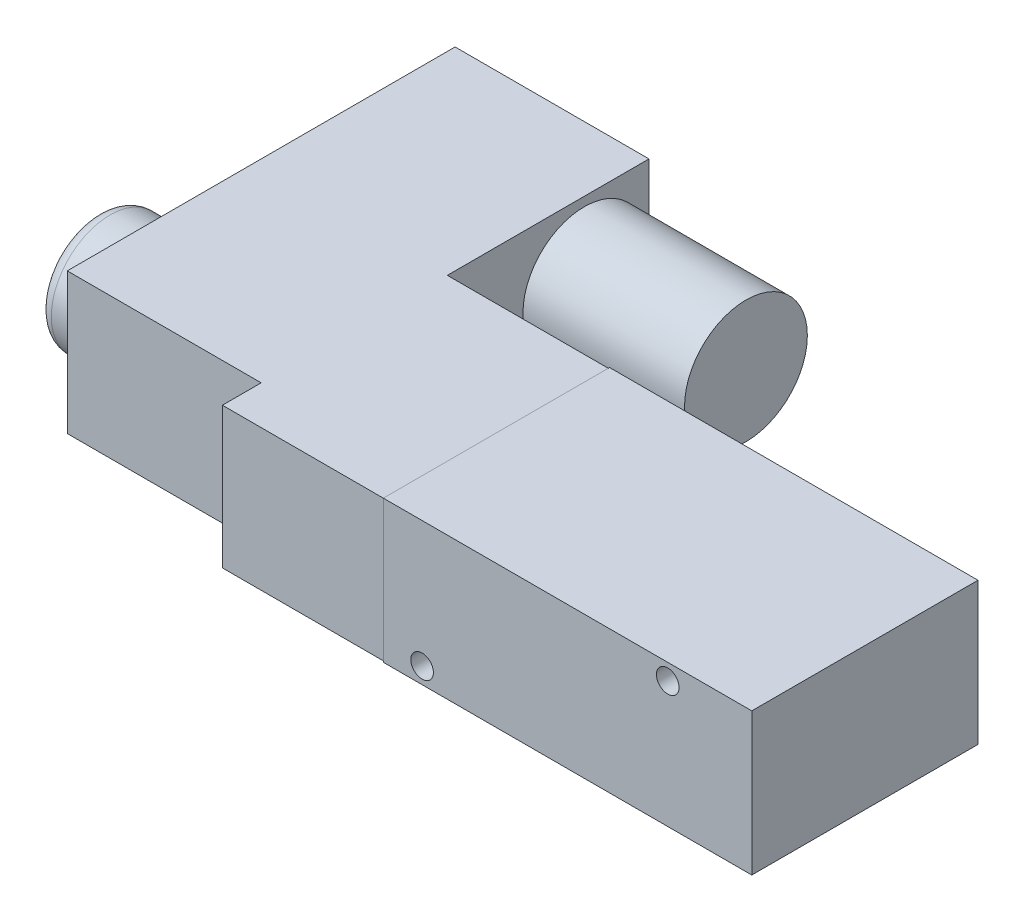
from build123d import *

# Parameters (mm, degrees)
SKETCH_1_W                 = 50
SKETCH_1_H                 = 22
EXTRUDE_1_DEPTH            = 35
SKETCH_2_R                 = 1.27968475
SKETCH_2_R_2               = 1.164740644
CUT_EXTRUDE_1_DEPTH        = 10
HOLE_WIZARD_1_2_13_1_D     = 10.71626
HOLE_WIZARD_1_2_13_1_DEPTH = 31.26
HOLE_WIZARD_1_2_13_1_TIP   = 3.219489309
CUT_EXTRUDE_2_REACH        = 46.396
SKETCH_5_R                 = 1.75
SKETCH_6_W                 = 35
SKETCH_6_H                 = 22
EXTRUDE_3_DEPTH            = 7
SKETCH_7_W                 = 34.8
SKETCH_7_H                 = 21.8
EXTRUDE_4_DEPTH            = 25
SKETCH_8_W                 = 60
SKETCH_8_H                 = 21.8
EXTRUDE_5_DEPTH            = 30
SKETCH_9_R                 = 9.5
EXTRUDE_6_DEPTH            = 25
SKETCH_10_R                = 9.084139512
EXTRUDE_7_DEPTH            = 8
FILLET_1_R                 = 2


with BuildPart() as part:
    # 草图1 → 凸台-拉伸1 (new body)
    with BuildSketch(Plane.XY):
        Rectangle(SKETCH_1_W, SKETCH_1_H)
    extrude(amount=EXTRUDE_1_DEPTH)

    # 草图2 → 切除-拉伸1 (cut)
    with BuildSketch(Plane(origin=(0, 0, 0), x_dir=(-1, 0, 0), z_dir=(0, 0, -1))):
        with Locations((-10, -1)):
            Circle(SKETCH_2_R)
        with Locations((10, 1)):
            Circle(SKETCH_2_R_2)
    extrude(amount=-CUT_EXTRUDE_1_DEPTH, mode=Mode.SUBTRACT)

    # 1/2-13 螺纹孔1
    with Locations(Plane(origin=(0, 0, 0), x_dir=(-1, 0, 0), z_dir=(0, 0, -1))):
        with Locations((10, 1), (-10, -1)):
            Hole(HOLE_WIZARD_1_2_13_1_D / 2, depth=HOLE_WIZARD_1_2_13_1_DEPTH)
            with Locations((0, 0, -(HOLE_WIZARD_1_2_13_1_DEPTH + HOLE_WIZARD_1_2_13_1_TIP / 2))):  # 118° drill point
                Cone(0, HOLE_WIZARD_1_2_13_1_D / 2, HOLE_WIZARD_1_2_13_1_TIP, mode=Mode.SUBTRACT)

    # 草图5 → 切除-拉伸2 (cut, up to next)
    with BuildSketch(Plane(origin=(0, 0, 0), x_dir=(-1, 0, 0), z_dir=(0, 0, -1)), mode=Mode.PRIVATE) as cut_extrude_2_sk1:
        with Locations((-19, 8.5)):
            Circle(SKETCH_5_R)
    cut_extrude_2_tool1 = extrude(cut_extrude_2_sk1.sketch, amount=-CUT_EXTRUDE_2_REACH, mode=Mode.PRIVATE) & part.part
    # 草图5 → 切除-拉伸2 (cut, up to next)
    with BuildSketch(Plane(origin=(0, 0, 0), x_dir=(-1, 0, 0), z_dir=(0, 0, -1)), mode=Mode.PRIVATE) as cut_extrude_2_sk2:
        with Locations((19, -8.5)):
            Circle(SKETCH_5_R)
    cut_extrude_2_tool2 = extrude(cut_extrude_2_sk2.sketch, amount=-CUT_EXTRUDE_2_REACH, mode=Mode.PRIVATE) & part.part
    add(cut_extrude_2_tool1.solids().sort_by_distance((19, 8.5, 0))[0], mode=Mode.SUBTRACT)
    add(cut_extrude_2_tool2.solids().sort_by_distance((-19, -8.5, 0))[0], mode=Mode.SUBTRACT)

    # 草图6 → 凸台-拉伸3 (add)
    with BuildSketch(Plane(origin=(25, 0, 0), x_dir=(0, 0, -1), z_dir=(1, 0, 0))):
        with Locations((-17.5, 0)):
            Rectangle(SKETCH_6_W, SKETCH_6_H)
    extrude(amount=EXTRUDE_3_DEPTH)

    # 草图7 → 凸台-拉伸4 (add)
    with BuildSketch(Plane.ZY.offset(25)):
        with Locations((17.5, 0)):
            Rectangle(SKETCH_7_W, SKETCH_7_H)
    extrude(amount=EXTRUDE_4_DEPTH)

    # 草图8 → 凸台-拉伸5 (add)
    with BuildSketch(Plane.ZY.offset(50)):
        with Locations((-1.1, 0)):
            Rectangle(SKETCH_8_W, SKETCH_8_H)
    extrude(amount=EXTRUDE_5_DEPTH)

    # 草图9 → 凸台-拉伸6 (add)
    with BuildSketch(Plane(origin=(-50, 0, 0), x_dir=(0, 0, -1), z_dir=(1, 0, 0))):
        with Locations(Location((21.1, 0, 0), (0, 0, 180))):
            Circle(SKETCH_9_R)
    extrude(amount=EXTRUDE_6_DEPTH)

    # 草图10 → 凸台-拉伸7 (add)
    with BuildSketch(Plane.ZY.offset(80)):
        with Locations((16.280298675, 0)):
            Circle(SKETCH_10_R)
    extrude(amount=EXTRUDE_7_DEPTH)

    # 圆角1
    fillet_1_edges = [part.edges().sort_by_distance(p)[0] for p in [
        (-88, 0, 7.196159162),
    ]]
    fillet(fillet_1_edges, radius=FILLET_1_R)


solid = part.part
